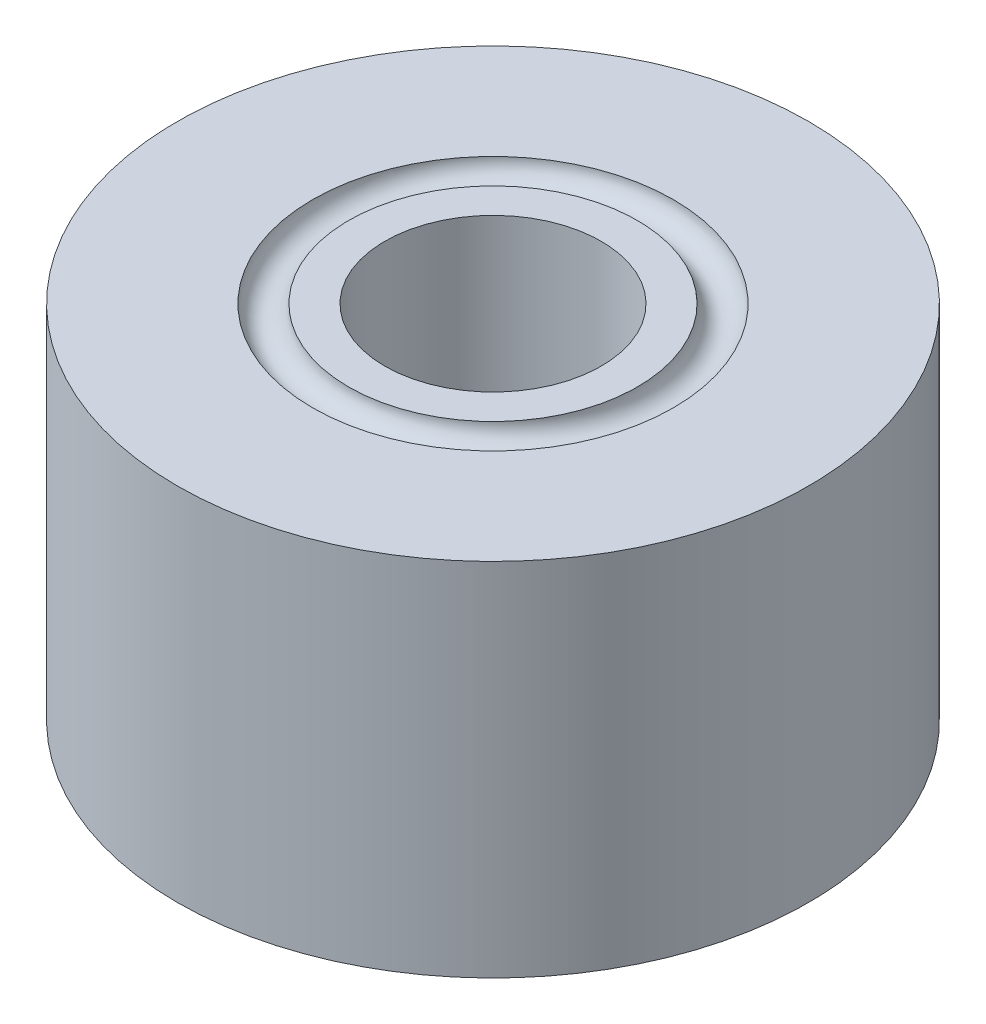
from build123d import *

# Parameters (mm, degrees)
SKETCH2_R            = 17.5
BOSS_EXTRUDE1_DEPTH  = 20
CUT_SWEEP1_PROFILE_R = 1
SKETCH62_R           = 2.5
CUT_EXTRUDE3_DEPTH   = 32.819805153
SKETCH65_R           = 6
CUT_EXTRUDE4_DEPTH   = 11


with BuildPart() as part:
    # Sketch2 → Boss-Extrude1 (new body)
    with BuildSketch(Plane(origin=(0, 0, 0), x_dir=(1, 0, 0), z_dir=(0, 1, 0))):
        with Locations(Location((0, 0, 0), (0, 0, 270))):
            Circle(SKETCH2_R)
    extrude(amount=BOSS_EXTRUDE1_DEPTH)

    # Cut-Sweep1: sweep along a path in Sketch39
    with BuildLine(Plane(origin=(0, 20, 0), x_dir=(1, 0, 0), z_dir=(0, 1, 0))) as cut_sweep1_path:
        CenterArc((0, 0), 9, 0, 360)
    # Cut-Sweep1 profile (on start of the path) → Cut-Sweep1 (sweep, cut)
    with BuildSketch(Plane(origin=(9, 20, 0), x_dir=(-1, 0, 0), z_dir=(0, 0, -1))):
        Circle(CUT_SWEEP1_PROFILE_R)
    sweep(path=cut_sweep1_path.line, mode=Mode.SUBTRACT)

    # Sketch62 → Cut-Extrude3 (cut, through all)
    with BuildSketch(Plane(origin=(0, 0, 0), x_dir=(1, 0, 0), z_dir=(0, 1, 0))):
        with Locations(Location((0, 0, 0), (0, 0, 270))):
            Circle(SKETCH62_R)
    extrude(amount=CUT_EXTRUDE3_DEPTH, mode=Mode.SUBTRACT)

    # Sketch65 → Cut-Extrude4 (cut)
    with BuildSketch(Plane(origin=(0, 20, 0), x_dir=(1, 0, 0), z_dir=(0, 1, 0))):
        with Locations(Location((0, 0, 0), (0, 0, 270))):
            Circle(SKETCH65_R)
    extrude(amount=-CUT_EXTRUDE4_DEPTH, mode=Mode.SUBTRACT)


solid = part.part
